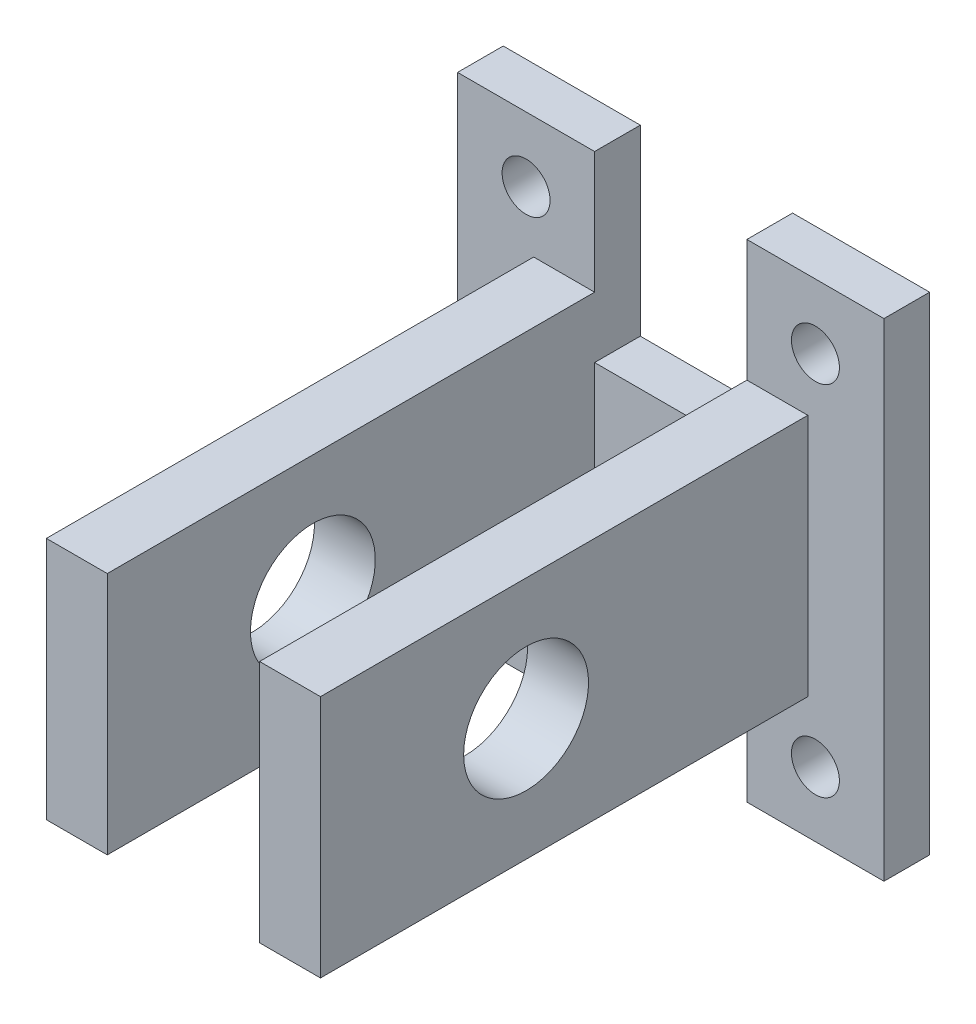
from build123d import *

# Parameters (mm, degrees)
SKETCH1_R           = 1.575
BOSS_EXTRUDE1_DEPTH = 3
SKETCH2_W           = 4
SKETCH2_H           = 16
BOSS_EXTRUDE2_DEPTH = 32
SKETCH3_R           = 4.1
CUT_EXTRUDE1_DEPTH  = 35


with BuildPart() as part:
    # Sketch1 → Boss-Extrude1 (new body)
    with BuildSketch(Plane.XY):
        Polygon((0, 0), (0, 32), (9, 32), (9, 20), (19, 20), (19, 32), (28, 32), (28, 0), (19, 0), (19, 12), (9, 12), (9, 0), align=None)
        with Locations((4.5, 27.75)):
            Circle(SKETCH1_R, mode=Mode.SUBTRACT)
        with Locations((4.5, 4.25)):
            Circle(SKETCH1_R, mode=Mode.SUBTRACT)
        with Locations(Location((23.5, 4.25, 0), (0, 0, 180))):
            Circle(SKETCH1_R, mode=Mode.SUBTRACT)
        with Locations(Location((23.5, 27.75, 0), (0, 0, 180))):
            Circle(SKETCH1_R, mode=Mode.SUBTRACT)
    extrude(amount=BOSS_EXTRUDE1_DEPTH)

    # Sketch2 → Boss-Extrude2 (add)
    with BuildSketch(Plane.XY.offset(3)):
        with Locations((7, 16)):
            Rectangle(SKETCH2_W, SKETCH2_H)
        with Locations((21, 16)):
            Rectangle(SKETCH2_W, SKETCH2_H)
    extrude(amount=BOSS_EXTRUDE2_DEPTH)

    # Sketch3 → Cut-Extrude1 (cut)
    with BuildSketch(Plane.ZY.offset(-5)):
        with Locations((21.5, 16)):
            Circle(SKETCH3_R)
    extrude(amount=-CUT_EXTRUDE1_DEPTH, mode=Mode.SUBTRACT)


solid = part.part
